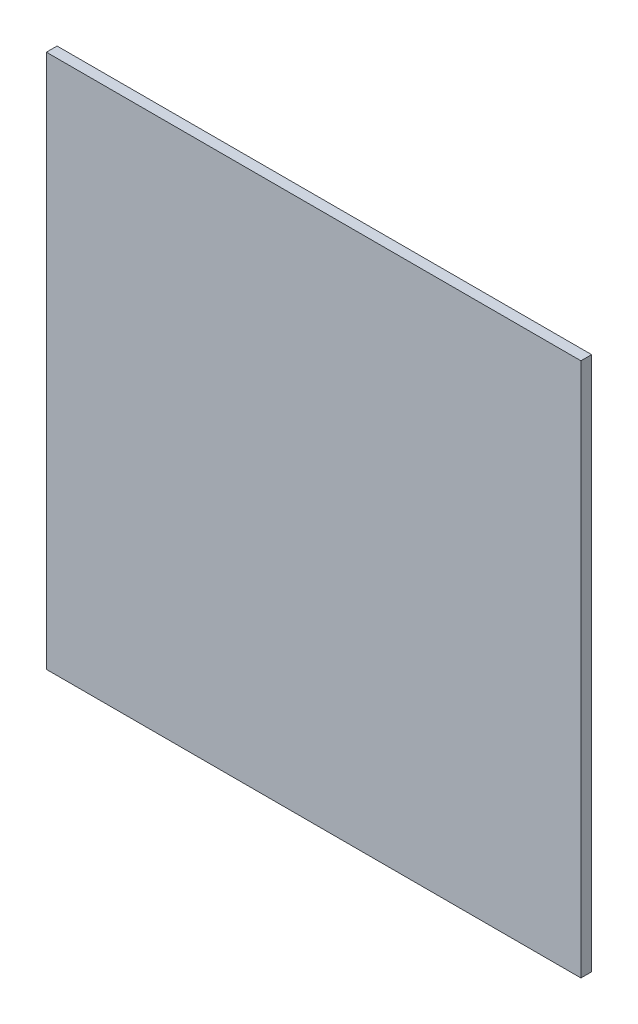
from build123d import *

# Parameters (mm, degrees)
ESQUISSE1_W        = 500
ESQUISSE1_H        = 500
BOSS_EXTRU_1_DEPTH = 10


with BuildPart() as part:
    # Esquisse1 → Boss.-Extru.1 (new body)
    with BuildSketch(Plane.XY):
        with Locations((-463.790215863, 121.495327103)):
            Rectangle(ESQUISSE1_W, ESQUISSE1_H)
    extrude(amount=BOSS_EXTRU_1_DEPTH)


solid = part.part
